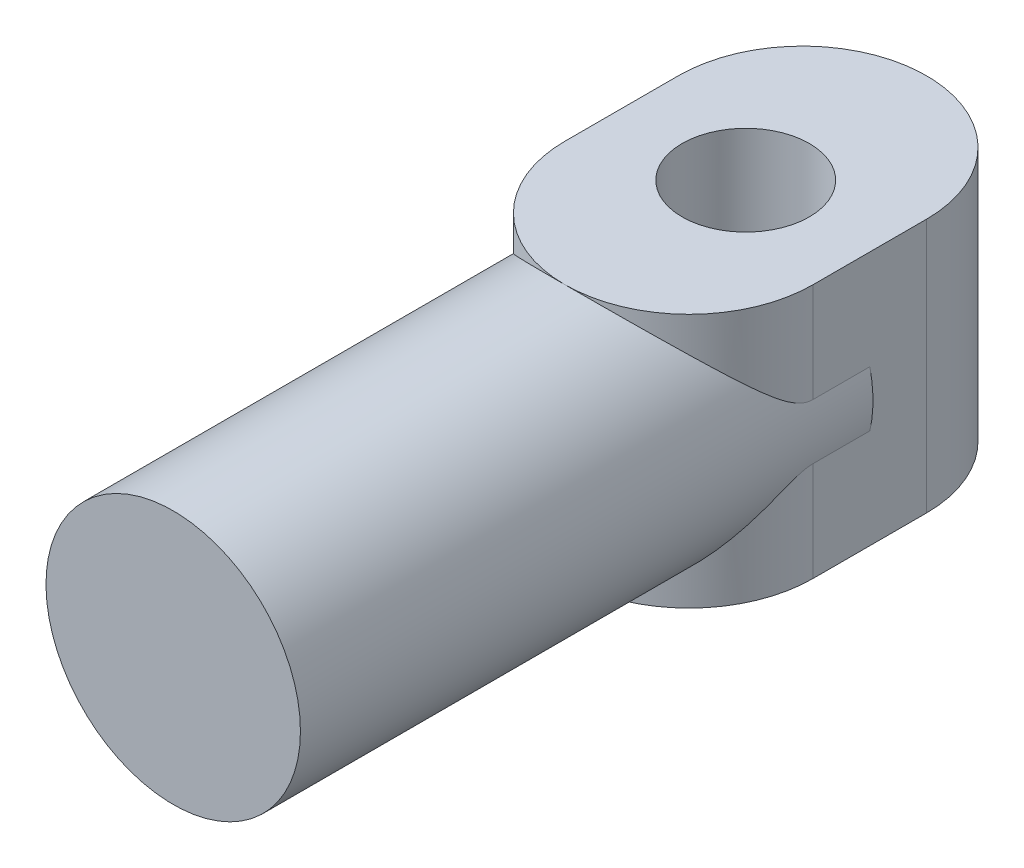
from build123d import *

# Parameters (mm, degrees)
SKETCH2_R           = 5
BOSS_EXTRUDE2_DEPTH = 22.5
BOSS_EXTRUDE3_DEPTH = 5
SKETCH4_R           = 2.5
CUT_EXTRUDE1_DEPTH  = 15


with BuildPart() as part:
    # Sketch2 → Boss-Extrude2 (new body)
    with BuildSketch(Plane.XY):
        with Locations(Location((0, 0, 0), (0, 0, 180))):
            Circle(SKETCH2_R)
    extrude(amount=BOSS_EXTRUDE2_DEPTH)

    # Sketch3 → Boss-Extrude3 (add, symmetric)
    with BuildSketch(Plane(origin=(0, 0, 0), x_dir=(1, 0, 0), z_dir=(0, 1, 0))):
        with BuildLine():
            Line((-4.879396794, -2.229791716), (-4.879396794, 2.229791716))
            ThreePointArc((-4.879396794, 2.229791716), (0, 7.10918851), (4.879396794, 2.229791716))
            Line((4.879396794, 2.229791716), (4.879396794, -2.229791716))
            ThreePointArc((4.879396794, -2.229791716), (0, -7.10918851), (-4.879396794, -2.229791716))
        make_face()
    extrude(amount=BOSS_EXTRUDE3_DEPTH, both=True)

    # Sketch4 → Cut-Extrude1 (cut)
    with BuildSketch(Plane.XZ.offset(5)):
        with Locations(Location((0, 0, 0), (0, 0, 270))):
            Circle(SKETCH4_R)
    extrude(amount=-CUT_EXTRUDE1_DEPTH, mode=Mode.SUBTRACT)


solid = part.part
